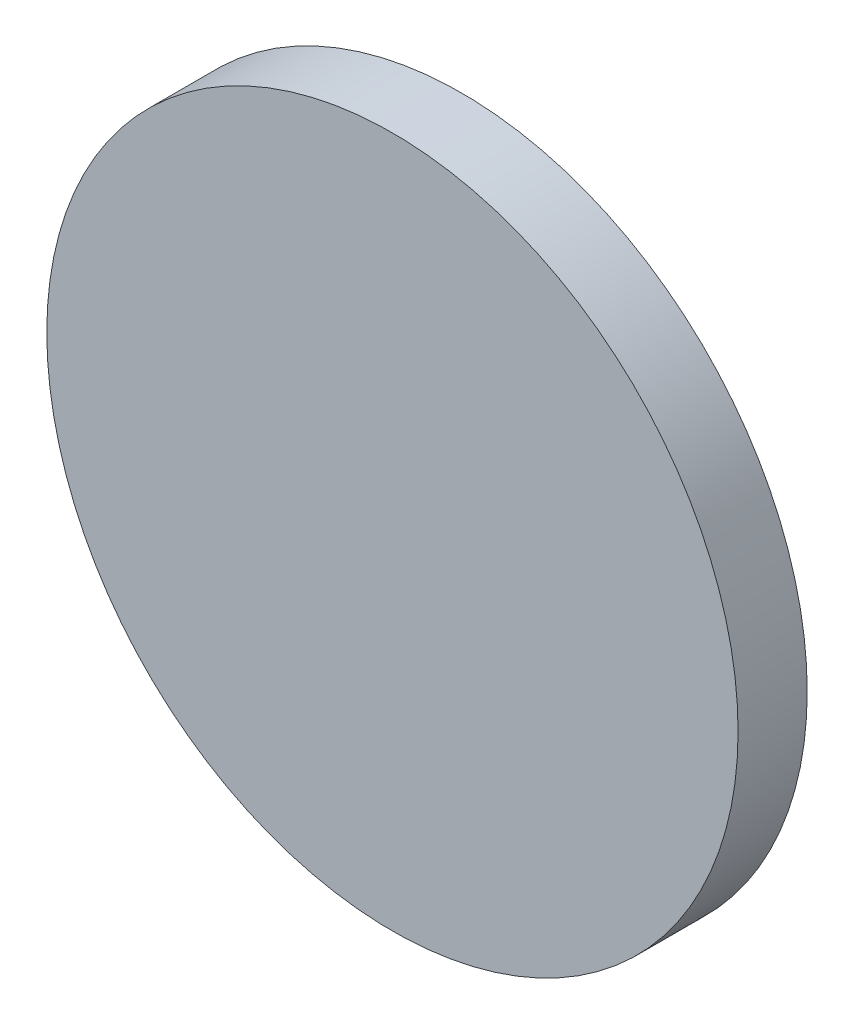
from build123d import *

# Parameters (mm, degrees)
SKETCH2_R           = 254
BOSS_EXTRUDE1_DEPTH = 50.8


with BuildPart() as part:
    # Sketch2 → Boss-Extrude1 (new body)
    with BuildSketch(Plane.XY):
        Circle(SKETCH2_R)
    extrude(amount=BOSS_EXTRUDE1_DEPTH)


solid = part.part
